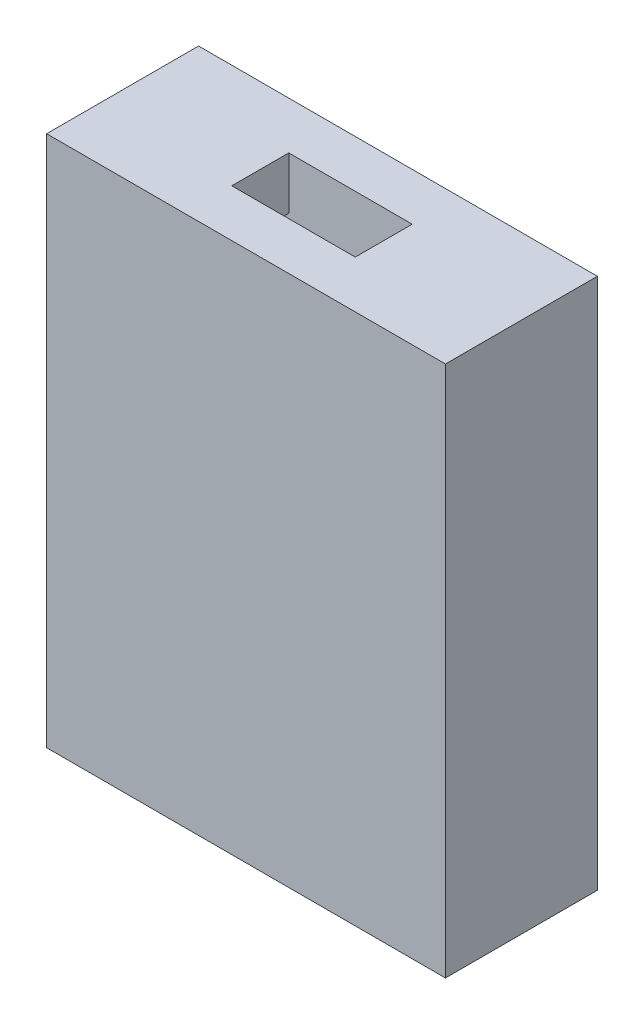
from build123d import *

# Parameters (mm, degrees)
ESQUISSE1_W             = 42
ESQUISSE1_H             = 16
BOSS_EXTRU_1_DEPTH      = 56
ESQUISSE2_W             = 13
ESQUISSE2_H             = 6
ENL_V_MAT_EXTRU_1_DEPTH = 11
ESQUISSE3_W             = 6
ESQUISSE3_H             = 5.5
ENL_V_MAT_EXTRU_2_DEPTH = 63.898728127


with BuildPart() as part:
    # Esquisse1 → Boss.-Extru.1 (new body)
    with BuildSketch(Plane(origin=(0, 0, 0), x_dir=(1, 0, 0), z_dir=(0, 1, 0))):
        Rectangle(ESQUISSE1_W, ESQUISSE1_H)
    extrude(amount=BOSS_EXTRU_1_DEPTH)

    # Esquisse2 → Enlèv. mat.-Extru.1 (cut)
    with BuildSketch(Plane(origin=(0, 56, 0), x_dir=(1, 0, 0), z_dir=(0, 1, 0))):
        Rectangle(ESQUISSE2_W, ESQUISSE2_H)
    extrude(amount=-ENL_V_MAT_EXTRU_1_DEPTH, mode=Mode.SUBTRACT)

    # Esquisse3 → Enlèv. mat.-Extru.2 (cut, through all)
    with BuildSketch(Plane(origin=(-6.5, 0, 0), x_dir=(0, 0, -1), z_dir=(1, 0, 0))):
        with Locations((0, 47.75)):
            Rectangle(ESQUISSE3_W, ESQUISSE3_H)
    extrude(amount=-ENL_V_MAT_EXTRU_2_DEPTH, mode=Mode.SUBTRACT)


solid = part.part
